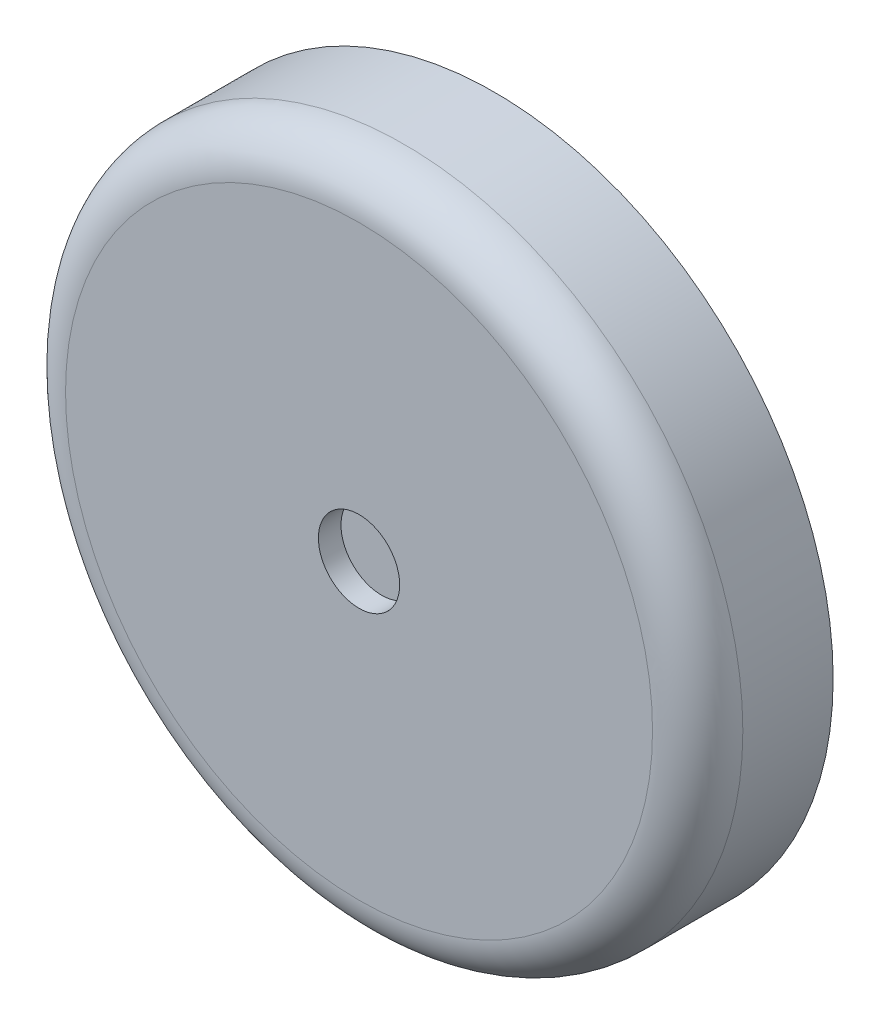
from build123d import *

# Parameters (mm, degrees)
SKETCH1_R           = 15
BOSS_EXTRUDE1_DEPTH = 6
FILLET1_R           = 2
SKETCH2_R           = 13.5
CUT_EXTRUDE1_DEPTH  = 4
FILLET2_R           = 2
SKETCH4_R           = 1.8
CUT_EXTRUDE3_DEPTH  = 1


with BuildPart() as part:
    # Sketch1 → Boss-Extrude1 (new body)
    with BuildSketch(Plane.XY):
        Circle(SKETCH1_R)
    extrude(amount=BOSS_EXTRUDE1_DEPTH)

    # Fillet1
    fillet1_edges = [part.edges().sort_by_distance(p)[0] for p in [
        (-15, 0, 6),
    ]]
    fillet(fillet1_edges, radius=FILLET1_R)

    # Sketch2 → Cut-Extrude1 (cut)
    with BuildSketch(Plane(origin=(0, 0, 0), x_dir=(-1, 0, 0), z_dir=(0, 0, -1))):
        Circle(SKETCH2_R)
    extrude(amount=-CUT_EXTRUDE1_DEPTH, mode=Mode.SUBTRACT)

    # Fillet2
    fillet2_edges = [part.edges().sort_by_distance(p)[0] for p in [
        (13.5, 0, 4),
    ]]
    fillet(fillet2_edges, radius=FILLET2_R)

    # Sketch4 → Cut-Extrude3 (cut)
    with BuildSketch(Plane.XY.offset(6)):
        Circle(SKETCH4_R)
    extrude(amount=-CUT_EXTRUDE3_DEPTH, mode=Mode.SUBTRACT)


solid = part.part
